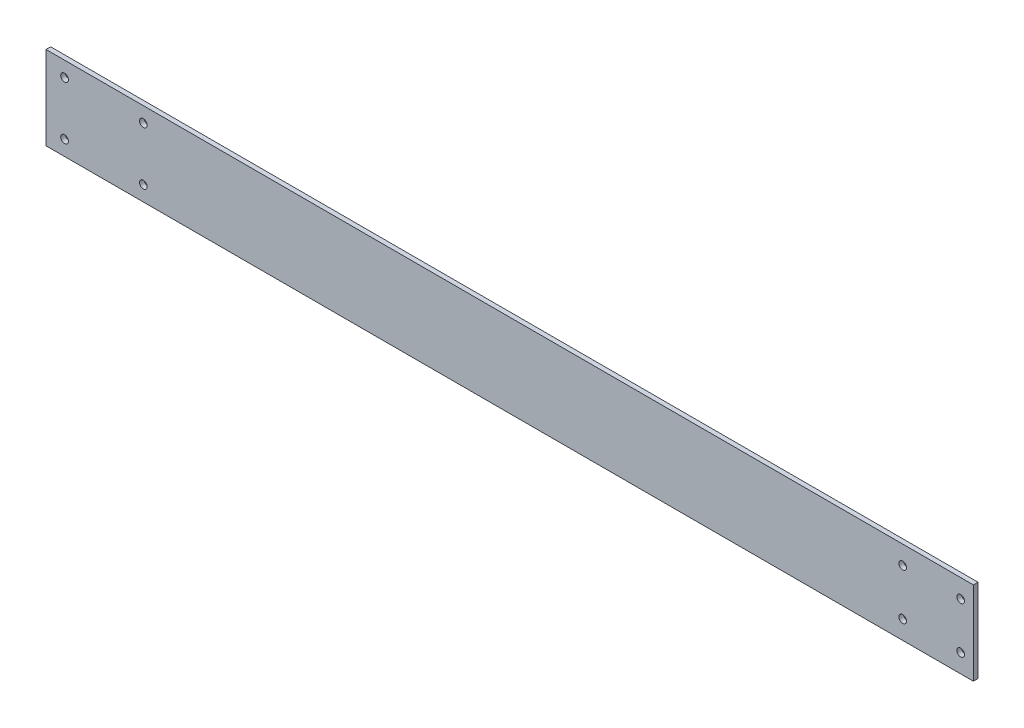
from build123d import *

# Parameters (mm, degrees)
SKETCH_1_W             = 400
SKETCH_1_H             = 36
EXTRUDE_1_DEPTH        = 2
HOLE_WIZARD_M4_1_D     = 3.3
HOLE_WIZARD_M4_1_DEPTH = 10
HOLE_WIZARD_M4_1_TIP   = 0.991420021
HOLE_WIZARD_M4_2_D     = 3.3
HOLE_WIZARD_M4_2_DEPTH = 10
HOLE_WIZARD_M4_2_TIP   = 0.991420021


with BuildPart() as part:
    # 草图1 → 凸台-拉伸1 (new body)
    with BuildSketch(Plane.XY):
        with Locations((200, -46.342266003)):
            Rectangle(SKETCH_1_W, SKETCH_1_H)
    extrude(amount=EXTRUDE_1_DEPTH)

    # M4 螺纹孔的螺纹孔钻头1
    with Locations(Plane(origin=(8, -34.842266003, 2), x_dir=(1, 0, 0), z_dir=(0, 0, 1))):
        with Locations((0, 0), (34, 0), (0, -23), (34, -23)):
            Hole(HOLE_WIZARD_M4_1_D / 2, depth=HOLE_WIZARD_M4_1_DEPTH)
            with Locations((0, 0, -(HOLE_WIZARD_M4_1_DEPTH + HOLE_WIZARD_M4_1_TIP / 2))):  # 118° drill point
                Cone(0, HOLE_WIZARD_M4_1_D / 2, HOLE_WIZARD_M4_1_TIP, mode=Mode.SUBTRACT)

    # M4 螺纹孔的螺纹孔钻头2
    with Locations(Plane(origin=(394.5, -36.342266003, 2), x_dir=(1, 0, 0), z_dir=(0, 0, 1))):
        with Locations((0, 0), (0, -20), (-25, -20), (-25, 0)):
            Hole(HOLE_WIZARD_M4_2_D / 2, depth=HOLE_WIZARD_M4_2_DEPTH)
            with Locations((0, 0, -(HOLE_WIZARD_M4_2_DEPTH + HOLE_WIZARD_M4_2_TIP / 2))):  # 118° drill point
                Cone(0, HOLE_WIZARD_M4_2_D / 2, HOLE_WIZARD_M4_2_TIP, mode=Mode.SUBTRACT)


solid = part.part
